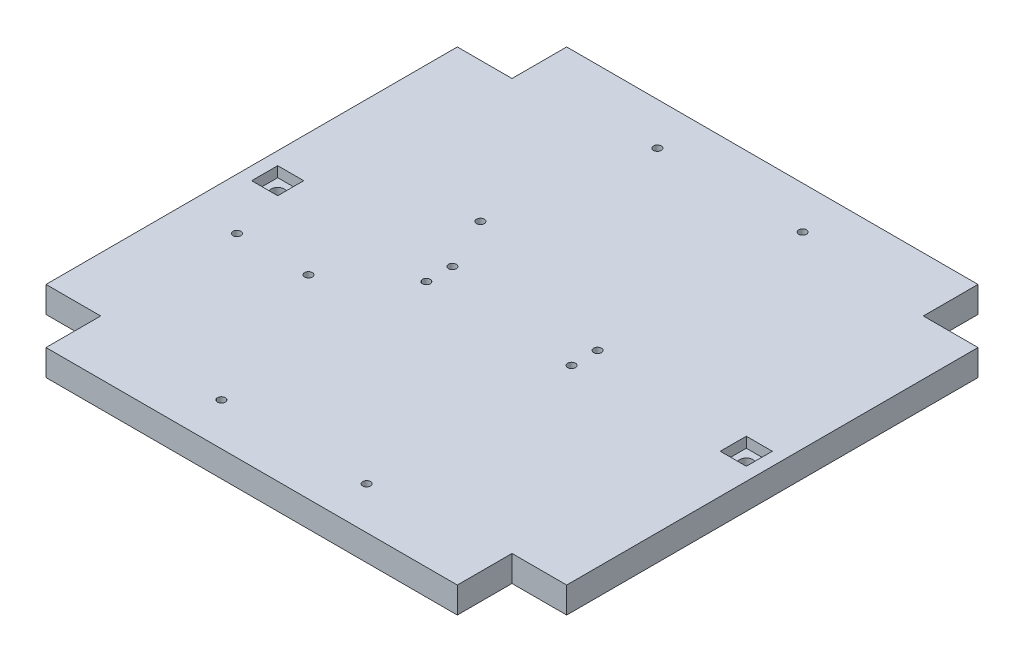
from build123d import *

# Parameters (mm, degrees)
BOSS_EXTRUDE1_DEPTH = 10
SKETCH2_R           = 2.5
CUT_EXTRUDE1_DEPTH  = 10
SKETCH3_R           = 1.5
CUT_EXTRUDE2_DEPTH  = 10
SKETCH6_R           = 1.5
CUT_EXTRUDE3_DEPTH  = 10
SKETCH7_W           = 10
SKETCH7_H           = 10
CUT_EXTRUDE4_DEPTH  = 4


with BuildPart() as part:
    # Sketch1 → Boss-Extrude1 (new body)
    with BuildSketch(Plane(origin=(0, 0, 0), x_dir=(1, 0, 0), z_dir=(0, 1, 0))):
        Polygon((-79, 100), (-79, 79), (-100, 79), (-100, -79), (-79, -79), (-79, -100), (79, -100), (79, -79), (100, -79), (100, 79), (79, 79), (79, 100), align=None)
    extrude(amount=BOSS_EXTRUDE1_DEPTH)

    # Sketch2 → Cut-Extrude1 (cut)
    with BuildSketch(Plane(origin=(0, 10, 0), x_dir=(1, 0, 0), z_dir=(0, 1, 0))):
        with Locations(Location((-90, 0, 0), (0, 0, 270))):
            Circle(SKETCH2_R)
        with Locations(Location((90, 0, 0), (0, 0, 90))):
            Circle(SKETCH2_R)
    extrude(amount=-CUT_EXTRUDE1_DEPTH, mode=Mode.SUBTRACT)

    # Sketch3 → Cut-Extrude2 (cut)
    with BuildSketch(Plane(origin=(0, 10, 0), x_dir=(1, 0, 0), z_dir=(0, 1, 0))):
        with Locations(Location((27.9, 83.74, 0), (0, 0, 270))):
            Circle(SKETCH3_R)
        with Locations(Location((27.9, 5, 0), (0, 0, 270))):
            Circle(SKETCH3_R)
        with Locations(Location((-27.9, 5, 0), (0, 0, 90))):
            Circle(SKETCH3_R)
        with Locations(Location((-27.9, 83.74, 0), (0, 0, 90))):
            Circle(SKETCH3_R)
        with Locations(Location((-27.9, -5, 0), (0, 0, 270))):
            Circle(SKETCH3_R)
        with Locations(Location((27.9, -5, 0), (0, 0, 90))):
            Circle(SKETCH3_R)
        with Locations(Location((27.9, -83.74, 0), (0, 0, 90))):
            Circle(SKETCH3_R)
        with Locations(Location((-27.9, -83.74, 0), (0, 0, 270))):
            Circle(SKETCH3_R)
    extrude(amount=-CUT_EXTRUDE2_DEPTH, mode=Mode.SUBTRACT)

    # Sketch6 → Cut-Extrude3 (cut)
    with BuildSketch(Plane(origin=(0, 10, 0), x_dir=(1, 0, 0), z_dir=(0, 1, 0))):
        with Locations(Location((-37.54, 25.4, 0), (0, 0, 270))):
            Circle(SKETCH6_R)
        with Locations(Location((-52.78, -25.4, 0), (0, 0, 270))):
            Circle(SKETCH6_R)
        with Locations(Location((-80.27, -25.4, 0), (0, 0, 270))):
            Circle(SKETCH6_R)
    extrude(amount=-CUT_EXTRUDE3_DEPTH, mode=Mode.SUBTRACT)

    # Sketch7 → Cut-Extrude4 (cut)
    with BuildSketch(Plane(origin=(0, 10, 0), x_dir=(1, 0, 0), z_dir=(0, 1, 0))):
        with Locations((-90, 0)):
            Rectangle(SKETCH7_W, SKETCH7_H)
        with Locations((90, 0)):
            Rectangle(SKETCH7_W, SKETCH7_H)
    extrude(amount=-CUT_EXTRUDE4_DEPTH, mode=Mode.SUBTRACT)


solid = part.part
